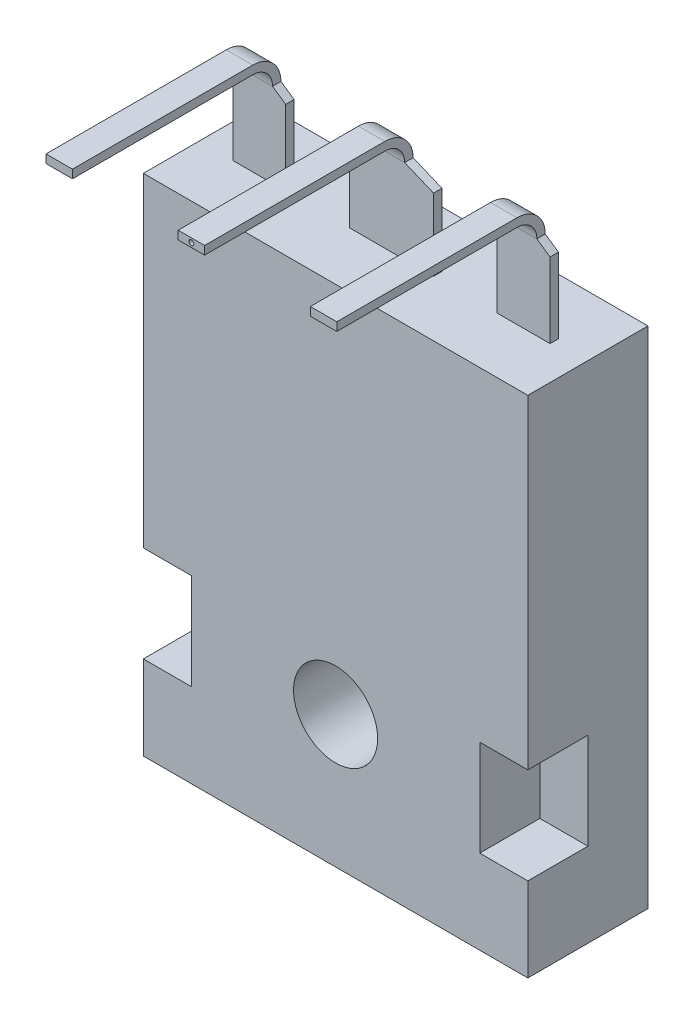
from build123d import *

# Parameters (mm, degrees)
SKETCH_1_W          = 16
SKETCH_1_H          = 21
SKETCH_1_R          = 1.75
EXTRUDE_1_DEPTH     = 5
EXTRUDE_1_2_DEPTH   = 16
CUT_EXTRUDE_1_DEPTH = 16
SKETCH_4_W          = 3.81913455
SKETCH_4_H          = 4
CUT_EXTRUDE_2_DEPTH = 2.5
SKETCH_5_R          = 0.1
CUT_EXTRUDE_3_DEPTH = 2


with BuildPart() as part:
    # Эскиз1 → Extrude 1 (new body)
    with BuildSketch(Plane.XY):
        with Locations((0, 5)):
            Rectangle(SKETCH_1_W, SKETCH_1_H)
        Circle(SKETCH_1_R, mode=Mode.SUBTRACT)
    extrude(amount=EXTRUDE_1_DEPTH)

    # Эскиз2 → Extrude 1 2 (add)
    with BuildSketch(Plane.ZY.offset(8)):
        with BuildLine():
            Line((2.675, 15.5), (2.675, 19))
            ThreePointArc((2.675, 19), (2.916636906, 19.583363094), (3.5, 19.825))
            Line((3.5, 19.825), (11, 19.825))
            Line((11, 19.825), (11, 20.175))
            Line((11, 20.175), (3.5, 20.175))
            ThreePointArc((3.5, 20.175), (2.669149532, 19.830850468), (2.325, 19))
            Line((2.325, 19), (2.325, 15.5))
            Line((2.325, 15.5), (2.675, 15.5))
        make_face()
    extrude(amount=-EXTRUDE_1_2_DEPTH)

    # Эскиз3 → Вырез-Вытянуть1 (cut)
    with BuildSketch(Plane(origin=(0, 0, 2.325), x_dir=(-1, 0, 0), z_dir=(0, 0, -1))):
        Polygon((-1.75, 15.5), (-1.75, 18.5), (-0.55, 19), (-0.55, 20.937907948), (-4.95, 20.937907948), (-4.95, 19), (-4.4, 18.622085888), (-4.4, 15.5), align=None)
        Polygon((0.55, 19), (0.55, 20.937907948), (4.95, 20.937907948), (4.95, 19), (4.4, 18.622085888), (4.4, 15.5), (1.75, 15.5), (1.75, 18.5), align=None)
        Polygon((-6.05, 19), (-6.05, 20.937907948), (-9.320905805, 20.937907948), (-9.320905805, 15.5), (-6.6, 15.5), (-6.6, 18.622085888), align=None)
        Polygon((6.05, 19), (6.05, 20.937907948), (9.499807758, 20.937907948), (9.499807758, 15.5), (6.6, 15.5), (6.6, 18.622085888), align=None)
    extrude(amount=-CUT_EXTRUDE_1_DEPTH, mode=Mode.SUBTRACT)

    # Эскиз4 → Вырез-Вытянуть2 (cut)
    with BuildSketch(Plane(origin=(0, 0, 5), x_dir=(-1, 0, 0), z_dir=(0, 0, -1))):
        with Locations((7.909567275, 0)):
            Rectangle(SKETCH_4_W, SKETCH_4_H)
        with Locations((-7.909567275, 0)):
            Rectangle(SKETCH_4_W, SKETCH_4_H)
    extrude(amount=CUT_EXTRUDE_2_DEPTH, mode=Mode.SUBTRACT)

    # Эскиз5 → Вырез-Вытянуть3 (cut)
    with BuildSketch(Plane.XY.offset(11)):
        with Locations((0, 20)):
            Circle(SKETCH_5_R)
    extrude(amount=-CUT_EXTRUDE_3_DEPTH, mode=Mode.SUBTRACT)


solid = part.part
